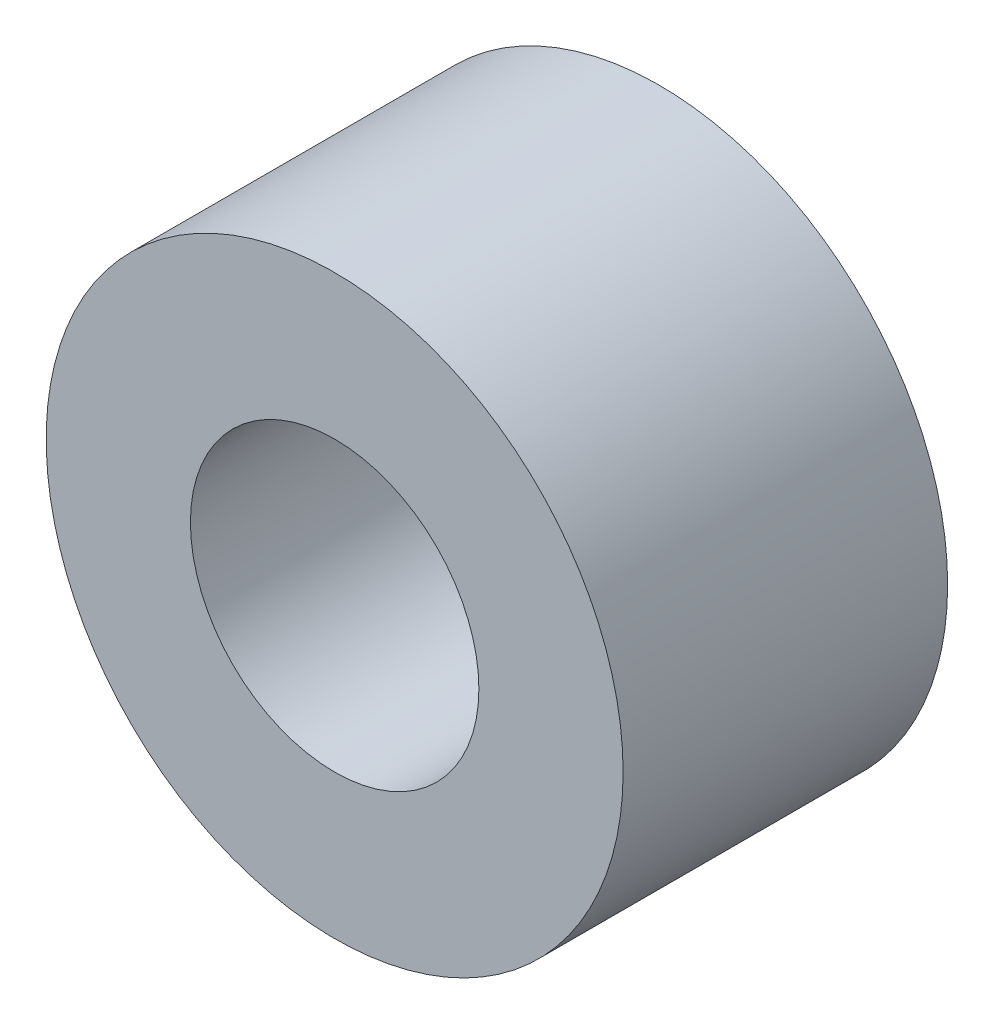
from build123d import *

# Parameters (mm, degrees)
SKETCH1_R           = 6.35
BOSS_EXTRUDE1_DEPTH = 7.14375
SKETCH2_R           = 3.175
CUT_EXTRUDE1_DEPTH  = 12.475110634


with BuildPart() as part:
    # Sketch1 → Boss-Extrude1 (new body)
    with BuildSketch(Plane.XY):
        Circle(SKETCH1_R)
    extrude(amount=BOSS_EXTRUDE1_DEPTH)

    # Sketch2 → Cut-Extrude1 (cut, through all)
    with BuildSketch(Plane.XY.offset(7.14375)):
        Circle(SKETCH2_R)
    extrude(amount=-CUT_EXTRUDE1_DEPTH, mode=Mode.SUBTRACT)


solid = part.part
